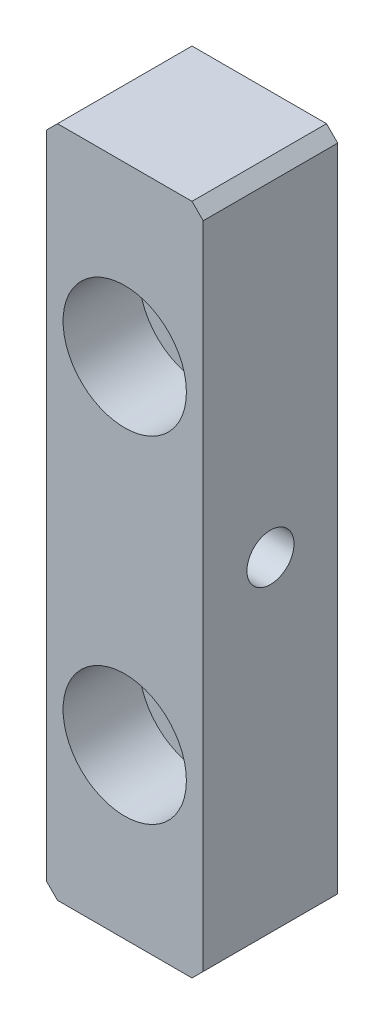
from build123d import *

# Parameters (mm, degrees)
SKETCH_1_W                   = 14
SKETCH_1_H                   = 60
EXTRUDE_1_DEPTH              = 12
HOLE_WIZARD_M6_1_D           = 6.6
HOLE_WIZARD_M6_1_CBORE_D     = 11
HOLE_WIZARD_M6_1_CBORE_DEPTH = 6.8
CHAMFER_1_SIZE               = 1
HOLE_WIZARD_M5_1_D           = 4.2


with BuildPart() as part:
    # 草图1 → 凸台-拉伸1 (new body)
    with BuildSketch(Plane.XY):
        Rectangle(SKETCH_1_W, SKETCH_1_H)
    extrude(amount=EXTRUDE_1_DEPTH)

    # M6 六角圆柱头螺钉的柱形沉头孔1 (through all)
    with Locations(Plane.XY.offset(12)):
        with Locations((0, 15)):
            hole_wizard_m6_1 = CounterBoreHole(HOLE_WIZARD_M6_1_D / 2, HOLE_WIZARD_M6_1_CBORE_D / 2, HOLE_WIZARD_M6_1_CBORE_DEPTH)

    # 镜向1: M6 六角圆柱头螺钉的柱形沉头孔1 across plane
    add(hole_wizard_m6_1.mirror(Plane.ZX), mode=Mode.SUBTRACT)

    # 倒角1
    chamfer_1_edges = [part.edges().sort_by_distance(p)[0] for p in [
        (7, -30, 6),
        (-7, -30, 6),
        (-7, 30, 6),
        (7, 30, 6),
    ]]
    chamfer(chamfer_1_edges, length=CHAMFER_1_SIZE)

    # M5 螺纹孔1 (through all)
    with Locations(Plane(origin=(7, 0, 0), x_dir=(0, 0, -1), z_dir=(1, 0, 0))):
        with Locations((-6, 0)):
            Hole(HOLE_WIZARD_M5_1_D / 2)


solid = part.part
